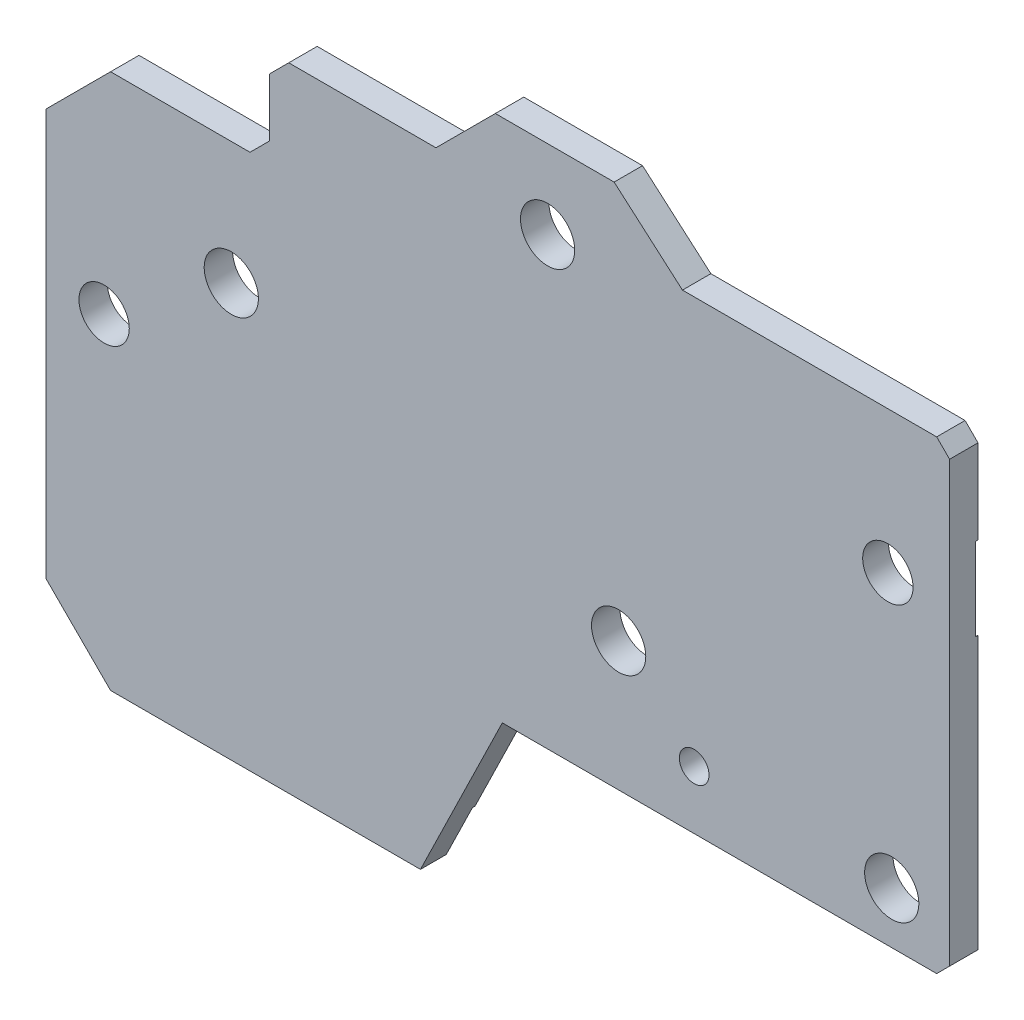
from build123d import *

# Parameters (mm, degrees)
SKETCH_1_R          = 2.1
SKETCH_1_R_2        = 4.2
SKETCH_1_R_3        = 2.7
EXTRUDE_1_DEPTH     = 3.2
EXTRUDE_START       = -3.2
SKETCH_3_R          = 4.2
SKETCH_3_R_2        = 1.95
SKETCH_3_R_3        = 2.7
SKETCH_3_R_4        = 1.15
EXTRUDE_3_DEPTH     = 3.2
SKETCH_7_R          = 2.1
SKETCH_7_R_2        = 1.15
SKETCH_7_R_3        = 1.95
CUT_EXTRUDE_1_DEPTH = 1
CHAMFER_1_SIZE      = 1
CHAMFER_3_SIZE      = 1
SKETCH_12_R         = 1.95
CUT_EXTRUDE_2_DEPTH = 10
SKETCH_13_W         = 24.8
SKETCH_13_H         = 7.5
CUT_EXTRUDE_3_DEPTH = 10
CHAMFER_4_SIZE      = 1.5
SKETCH_15_R         = 2.55
CUT_EXTRUDE_5_DEPTH = 0.2
CHAMFER_5_SIZE      = 1
CUT_EXTRUDE_6_DEPTH = 0.2
SKETCH_17_W         = 17.729564923
SKETCH_17_H         = 70.765418615
CUT_EXTRUDE_7_DEPTH = 10
CHAMFER_6_SIZE      = 5


with BuildPart() as part:
    # 스케치1 → 보스-돌출1 (new body)
    with BuildSketch(Plane.XY):
        Polygon((0, 0), (36.5, 0), (42.840523651, 13), (77.480523651, 13), (77.480523651, 49), (56.791694673, 49), (51.5, 53.6), (42.3, 53.6), (37.7, 49), (11.9, 49), (0, 37.1), align=None)
        with Locations((46.35, 47.5)):
            Circle(SKETCH_1_R, mode=Mode.SUBTRACT)
        with Locations((12, 25)):
            Circle(SKETCH_1_R_2, mode=Mode.SUBTRACT)
        with Locations((57.7, 17.5)):
            Circle(SKETCH_1_R_3, mode=Mode.SUBTRACT)
        with Locations((51.85, 23)):
            Circle(SKETCH_1_R, mode=Mode.SUBTRACT)
        with Locations((73, 17)):
            Circle(SKETCH_1_R, mode=Mode.SUBTRACT)
        with Locations((21.85, 32)):
            Circle(SKETCH_1_R, mode=Mode.SUBTRACT)
    extrude(amount=EXTRUDE_1_DEPTH)

    # 스케치3 → 보스-돌출3 (add)
    # profile 1 of 2: a face of its own
    with BuildSketch(Plane.XY.offset(3.2).offset(EXTRUDE_START)):
        with Locations((12, 25)):
            Circle(SKETCH_3_R)
        with Locations((12, 25)):
            Circle(SKETCH_3_R_2, mode=Mode.SUBTRACT)
    # profile 2 of 2: a face of its own
    with BuildSketch(Plane.XY.offset(3.2).offset(EXTRUDE_START)):
        with Locations((57.7, 17.5)):
            Circle(SKETCH_3_R_3)
        with Locations((57.7, 17.5)):
            Circle(SKETCH_3_R_4, mode=Mode.SUBTRACT)
    extrude(amount=EXTRUDE_3_DEPTH)

    # 스케치7 → 컷-돌출1 (cut)
    with BuildSketch(Plane(origin=(0, 0, 0), x_dir=(-1, 0, 0), z_dir=(0, 0, -1))):
        Polygon((-11.9, 49), (-37.7, 49), (-42.3, 53.6), (-51.5, 53.6), (-56.791694673, 49), (-77.480523651, 49), (-77.480523651, 13), (-42.840523651, 13), (-36.5, 0), (0, 0), (0, 37.1), align=None)
        with Locations((-73, 17)):
            Circle(SKETCH_7_R, mode=Mode.SUBTRACT)
        with Locations(Location((-57.7, 17.5, 0), (0, 0, 180))):
            Circle(SKETCH_7_R_2, mode=Mode.SUBTRACT)
        with Locations((-51.85, 23)):
            Circle(SKETCH_7_R, mode=Mode.SUBTRACT)
        with Locations((-21.85, 32)):
            Circle(SKETCH_7_R, mode=Mode.SUBTRACT)
        with Locations(Location((-12, 25, 0), (0, 0, 180))):
            Circle(SKETCH_7_R_3, mode=Mode.SUBTRACT)
        with Locations((-46.35, 47.5)):
            Circle(SKETCH_7_R, mode=Mode.SUBTRACT)
    extrude(amount=-CUT_EXTRUDE_1_DEPTH, mode=Mode.SUBTRACT)

    # 모따기1
    chamfer_1_edges = [part.edges().sort_by_distance(p)[0] for p in [
        (0, 0, 2.1),
    ]]
    chamfer(chamfer_1_edges, length=CHAMFER_1_SIZE)

    # 모따기3
    chamfer_3_edges = [part.edges().sort_by_distance(p)[0] for p in [
        (77.480523651, 13, 2.1),
    ]]
    chamfer(chamfer_3_edges, length=CHAMFER_3_SIZE)

    # 스케치12 → 컷-돌출2 (cut)
    with BuildSketch(Plane(origin=(0, 0, 1), x_dir=(-1, 0, 0), z_dir=(0, 0, -1))):
        with Locations((-72.7, 38)):
            Circle(SKETCH_12_R)
    extrude(amount=-CUT_EXTRUDE_2_DEPTH, mode=Mode.SUBTRACT)

    # 스케치13 → 컷-돌출3 (cut)
    with BuildSketch(Plane.XY):
        with Locations((12.4, 45.25)):
            Rectangle(SKETCH_13_W, SKETCH_13_H)
    extrude(amount=CUT_EXTRUDE_3_DEPTH, mode=Mode.SUBTRACT)

    # 모따기4
    chamfer_4_edges = [part.edges().sort_by_distance(p)[0] for p in [
        (24.8, 49, 2.1),
        (24.8, 41.5, 2.1),
    ]]
    chamfer(chamfer_4_edges, length=CHAMFER_4_SIZE)

    # 스케치15 → 컷-돌출5 (cut)
    with BuildSketch(Plane(origin=(0, 0, 1), x_dir=(-1, 0, 0), z_dir=(0, 0, -1))):
        with Locations((-36.9, 45.7)):
            Circle(SKETCH_15_R)
        with BuildLine():
            Line((-72.7, 42.3), (-76, 42.3))
            ThreePointArc((-76, 42.3), (-76.707106781, 42.007106781), (-77, 41.3))
            Line((-77, 41.3), (-77, 34.7))
            ThreePointArc((-77, 34.7), (-76.707106781, 33.992893219), (-76, 33.7))
            Line((-76, 33.7), (-69.4, 33.7))
            ThreePointArc((-69.4, 33.7), (-68.692893219, 33.992893219), (-68.4, 34.7))
            Line((-68.4, 34.7), (-68.4, 38))
            ThreePointArc((-68.4, 38), (-69.659440841, 41.040559159), (-72.7, 42.3))
        make_face()
    extrude(amount=-CUT_EXTRUDE_5_DEPTH, mode=Mode.SUBTRACT)

    # 모따기5
    chamfer_5_edges = [part.edges().sort_by_distance(p)[0] for p in [
        (77.480523651, 49, 2.1),
    ]]
    chamfer(chamfer_5_edges, length=CHAMFER_5_SIZE)

    # 스케치16 → 컷-돌출6 (cut)
    with BuildSketch(Plane(origin=(0, 0, 1), x_dir=(-1, 0, 0), z_dir=(0, 0, -1))):
        with BuildLine():
            Line((-61.2, 19.810538853), (-61.2, 28.710538853))
            Line((-61.2, 28.710538853), (-77.480523651, 41.485624748))
            Line((-77.480523651, 41.485624748), (-77.480523651, 35.085624748))
            Line((-77.480523651, 35.085624748), (-64.5, 24.9))
            Line((-64.5, 24.9), (-64.5, 16))
            Line((-64.5, 16), (-61.5, 13))
            Line((-61.5, 13), (-61.2, 13))
            Line((-61.2, 13), (-54.8, 13))
            Line((-54.8, 13), (-54.8, 17.65))
            ThreePointArc((-54.8, 17.65), (-56.526900347, 19.23588339), (-58.8, 19.810538853))
            Line((-58.8, 19.810538853), (-61.2, 19.810538853))
        make_face()
        Polygon((-38.524090243, 4.15), (-34.374090243, 4.15), (-33.886357654, 3.15), (-32.886357654, 3.15), (-31.35, 0), (-36.5, 0), align=None)
    extrude(amount=-CUT_EXTRUDE_6_DEPTH, mode=Mode.SUBTRACT)

    # 스케치17 → 컷-돌출7 (cut)
    with BuildSketch(Plane.XY):
        with Locations((-1.364782461, 26.542327615)):
            Rectangle(SKETCH_17_W, SKETCH_17_H)
    extrude(amount=CUT_EXTRUDE_7_DEPTH, mode=Mode.SUBTRACT)

    # 모따기6
    chamfer_6_edges = [part.edges().sort_by_distance(p)[0] for p in [
        (7.5, 41.5, 2.1),
        (7.5, 0, 2.1),
    ]]
    chamfer(chamfer_6_edges, length=CHAMFER_6_SIZE)


solid = part.part
